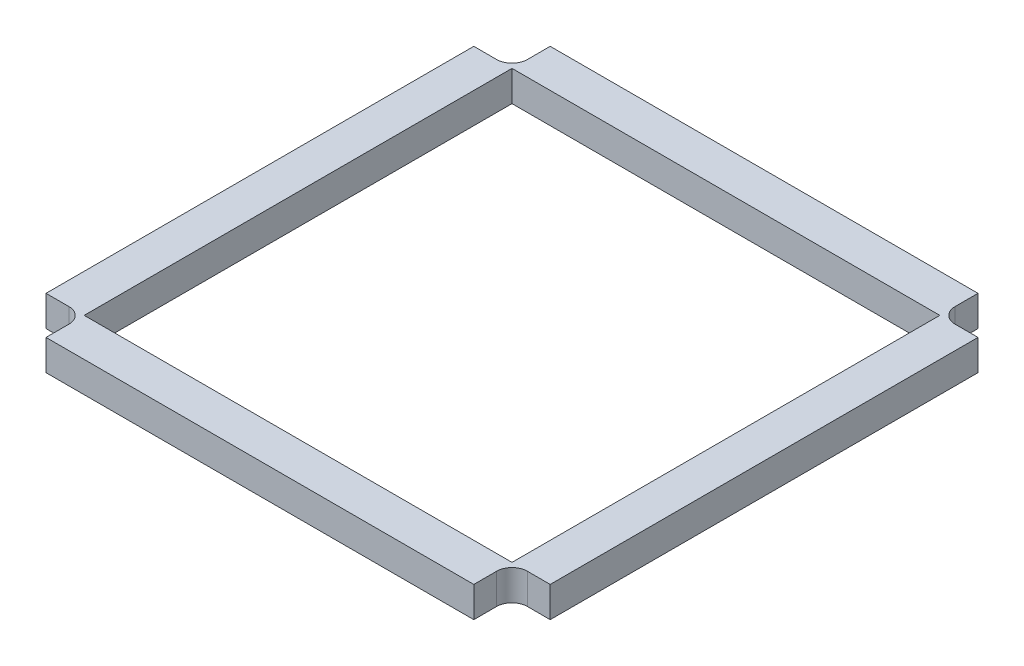
from build123d import *

# Parameters (mm, degrees)
CROQUIS1_W              = 165
CROQUIS1_H              = 165
CROQUIS1_W_2            = 140
CROQUIS1_H_2            = 140
SALIENTE_EXTRUIR1_DEPTH = 10
CORTAR_EXTRUIR1_DEPTH   = 10


with BuildPart() as part:
    # Croquis1 → Saliente-Extruir1 (new body)
    with BuildSketch(Plane(origin=(0, 0, 0), x_dir=(1, 0, 0), z_dir=(0, 1, 0))):
        with Locations((70, 70)):
            Rectangle(CROQUIS1_W, CROQUIS1_H)
        with Locations((70, 70)):
            Rectangle(CROQUIS1_W_2, CROQUIS1_H_2, mode=Mode.SUBTRACT)
    extrude(amount=SALIENTE_EXTRUIR1_DEPTH)

    # Croquis2 → Cortar-Extruir1 (cut)
    with BuildSketch(Plane(origin=(0, 10, 0), x_dir=(1, 0, 0), z_dir=(0, 1, 0))):
        with BuildLine():
            Line((0, 145), (0, 152.5))
            Line((0, 152.5), (-12.5, 152.5))
            Line((-12.5, 152.5), (-12.5, 140))
            Line((-12.5, 140), (-5, 140))
            ThreePointArc((-5, 140), (-1.464466094, 141.464466094), (0, 145))
        make_face()
        with BuildLine():
            Line((145, 140), (152.5, 140))
            Line((152.5, 140), (152.5, 152.5))
            Line((152.5, 152.5), (140, 152.5))
            Line((140, 152.5), (140, 145))
            ThreePointArc((140, 145), (141.464466094, 141.464466094), (145, 140))
        make_face()
        with BuildLine():
            Line((140, -5), (140, -12.5))
            Line((140, -12.5), (152.5, -12.5))
            Line((152.5, -12.5), (152.5, 0))
            Line((152.5, 0), (145, 0))
            ThreePointArc((145, 0), (141.464466094, -1.464466094), (140, -5))
        make_face()
        with BuildLine():
            Line((-5, 0), (-12.5, 0))
            Line((-12.5, 0), (-12.5, -12.5))
            Line((-12.5, -12.5), (0, -12.5))
            Line((0, -12.5), (0, -5))
            ThreePointArc((0, -5), (-1.464466094, -1.464466094), (-5, 0))
        make_face()
    extrude(amount=-CORTAR_EXTRUIR1_DEPTH, mode=Mode.SUBTRACT)


solid = part.part
